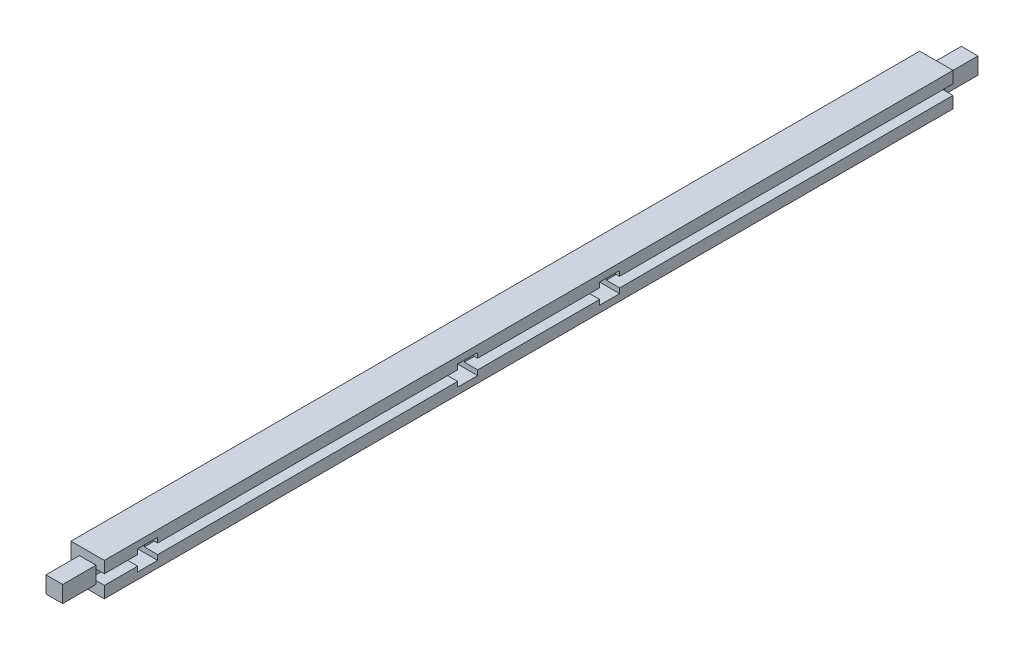
from build123d import *

# Parameters (mm, degrees)
SKETCH1_W           = 5
SKETCH1_H           = 5
BOSS_EXTRUDE1_DEPTH = 127.3
SKETCH2_W           = 2.5
SKETCH2_H           = 2.5
BOSS_EXTRUDE2_DEPTH = 5
SKETCH3_W           = 2.5
SKETCH3_H           = 2.5
BOSS_EXTRUDE3_DEPTH = 5
SKETCH4_W           = 3
SKETCH4_H           = 3
CUT_EXTRUDE1_DEPTH  = 30
SKETCH7_W           = 127.3
SKETCH7_H           = 1.5
CUT_EXTRUDE5_DEPTH  = 2


with BuildPart() as part:
    # Sketch1 → Boss-Extrude1 (new body)
    with BuildSketch(Plane.XY):
        with Locations((2.5, 2.5)):
            Rectangle(SKETCH1_W, SKETCH1_H)
    extrude(amount=BOSS_EXTRUDE1_DEPTH)

    # Sketch2 → Boss-Extrude2 (add)
    with BuildSketch(Plane(origin=(0, 0, 0), x_dir=(-1, 0, 0), z_dir=(0, 0, -1))):
        with Locations((-2.5, 2.5)):
            Rectangle(SKETCH2_W, SKETCH2_H)
    extrude(amount=BOSS_EXTRUDE2_DEPTH)

    # Sketch3 → Boss-Extrude3 (add)
    with BuildSketch(Plane.XY.offset(127.3)):
        with Locations((2.5, 2.5)):
            Rectangle(SKETCH3_W, SKETCH3_H)
    extrude(amount=BOSS_EXTRUDE3_DEPTH)

    # Sketch4 → Cut-Extrude1 (cut)
    with BuildSketch(Plane.ZY):
        with Locations((120.8, 2.5)):
            Rectangle(SKETCH4_W, SKETCH4_H)
        with Locations((51.5, 2.5)):
            Rectangle(SKETCH4_W, SKETCH4_H)
        with Locations((72.8, 2.5)):
            Rectangle(SKETCH4_W, SKETCH4_H)
    extrude(amount=-CUT_EXTRUDE1_DEPTH, mode=Mode.SUBTRACT)

    # Sketch7 → Cut-Extrude5 (cut)
    with BuildSketch(Plane(origin=(5, 0, 0), x_dir=(0, 0, -1), z_dir=(1, 0, 0))):
        with Locations((-63.65, 2.5)):
            Rectangle(SKETCH7_W, SKETCH7_H)
    extrude(amount=-CUT_EXTRUDE5_DEPTH, mode=Mode.SUBTRACT)


solid = part.part
